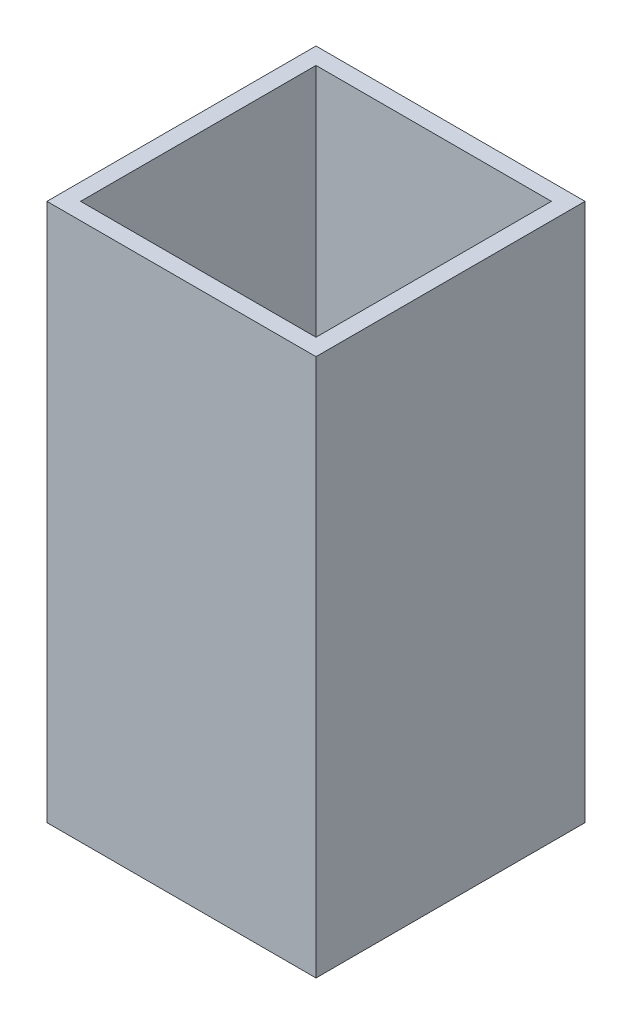
from build123d import *

# Parameters (mm, degrees)
SKETCH1_W           = 25.4
SKETCH1_H           = 25.4
SKETCH1_W_2         = 22.225
SKETCH1_H_2         = 22.225
BOSS_EXTRUDE1_DEPTH = 50.8


with BuildPart() as part:
    # Sketch1 → Boss-Extrude1 (new body)
    with BuildSketch(Plane(origin=(0, 0, 0), x_dir=(1, 0, 0), z_dir=(0, 1, 0))):
        Rectangle(SKETCH1_W, SKETCH1_H)
        Rectangle(SKETCH1_W_2, SKETCH1_H_2, mode=Mode.SUBTRACT)
    extrude(amount=BOSS_EXTRUDE1_DEPTH)


solid = part.part
